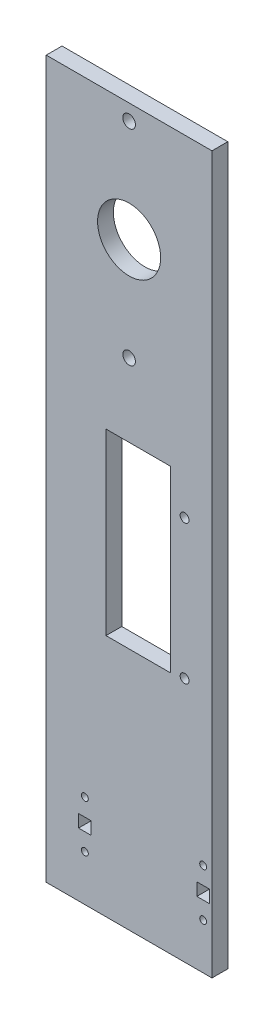
from build123d import *

# Parameters (mm, degrees)
SKETCH1_W           = 66.7
SKETCH1_H           = 288.29
SKETCH1_R           = 1.3890625
SKETCH1_R_2         = 1.7859375
SKETCH1_R_3         = 2.54
SKETCH1_R_4         = 12.7
SKETCH1_W_2         = 5.08
SKETCH1_H_2         = 5.08
SKETCH1_W_3         = 26
SKETCH1_H_3         = 72
BOSS_EXTRUDE1_DEPTH = 6.35


with BuildPart() as part:
    # Sketch1 → Boss-Extrude1 (new body)
    with BuildSketch(Plane.XY):
        with Locations((33.35, -144.145)):
            Rectangle(SKETCH1_W, SKETCH1_H)
        with Locations((63.16, -269.875)):
            Circle(SKETCH1_R, mode=Mode.SUBTRACT)
        with Locations((63.16, -250.825)):
            Circle(SKETCH1_R, mode=Mode.SUBTRACT)
        with Locations((15.54, -250.825)):
            Circle(SKETCH1_R, mode=Mode.SUBTRACT)
        with Locations((15.54, -269.875)):
            Circle(SKETCH1_R, mode=Mode.SUBTRACT)
        with Locations((55.675, -133.39)):
            Circle(SKETCH1_R_2, mode=Mode.SUBTRACT)
        with Locations((55.675, -189.39)):
            Circle(SKETCH1_R_2, mode=Mode.SUBTRACT)
        with Locations((33.35, -88.85)):
            Circle(SKETCH1_R_3, mode=Mode.SUBTRACT)
        with Locations((33.35, -47.6)):
            Circle(SKETCH1_R_4, mode=Mode.SUBTRACT)
        with Locations((33.35, -6.35)):
            Circle(SKETCH1_R_3, mode=Mode.SUBTRACT)
        with Locations((63.16, -260.35)):
            Rectangle(SKETCH1_W_2, SKETCH1_H_2, mode=Mode.SUBTRACT)
        with Locations((15.54, -260.35)):
            Rectangle(SKETCH1_W_2, SKETCH1_H_2, mode=Mode.SUBTRACT)
        with Locations((37.05, -154.29)):
            Rectangle(SKETCH1_W_3, SKETCH1_H_3, mode=Mode.SUBTRACT)
    extrude(amount=BOSS_EXTRUDE1_DEPTH)


solid = part.part
